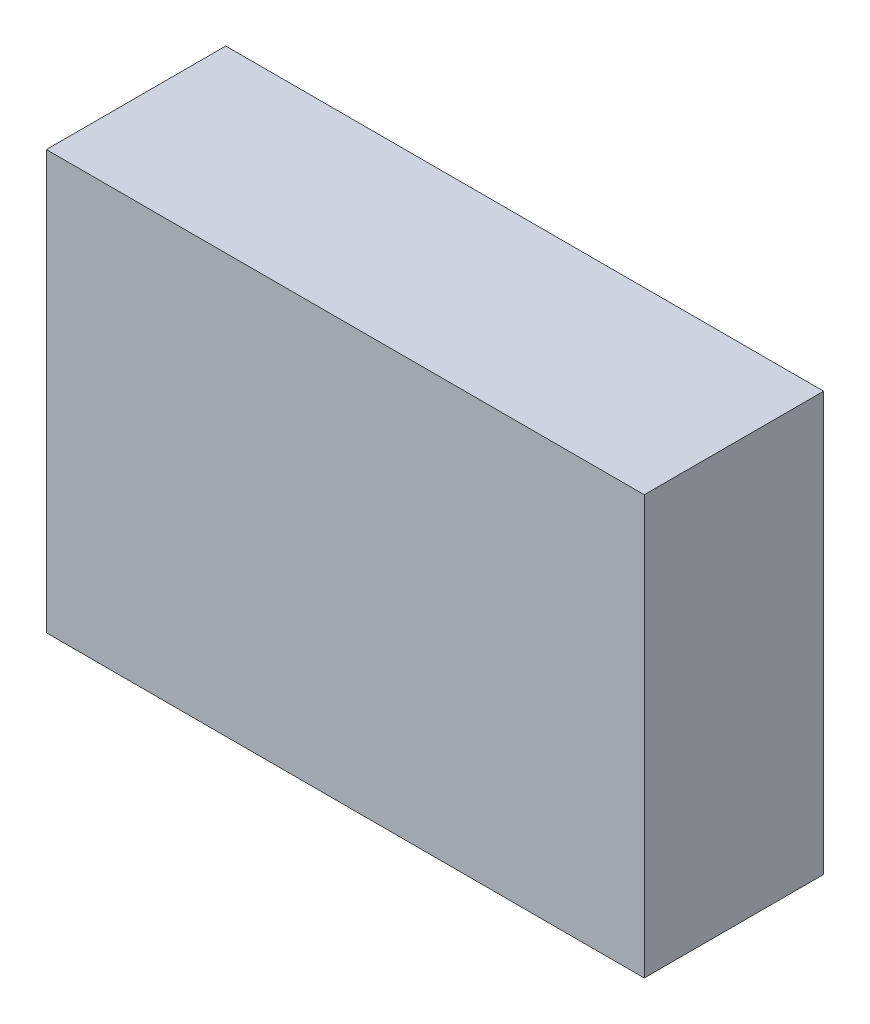
from build123d import *

# Parameters (mm, degrees)
SKETCH1_W           = 1000
SKETCH1_H           = 700
BOSS_EXTRUDE1_DEPTH = 300


with BuildPart() as part:
    # Sketch1 → Boss-Extrude1 (new body)
    with BuildSketch(Plane.XY):
        with Locations((500, 350)):
            Rectangle(SKETCH1_W, SKETCH1_H)
    extrude(amount=BOSS_EXTRUDE1_DEPTH)


solid = part.part
